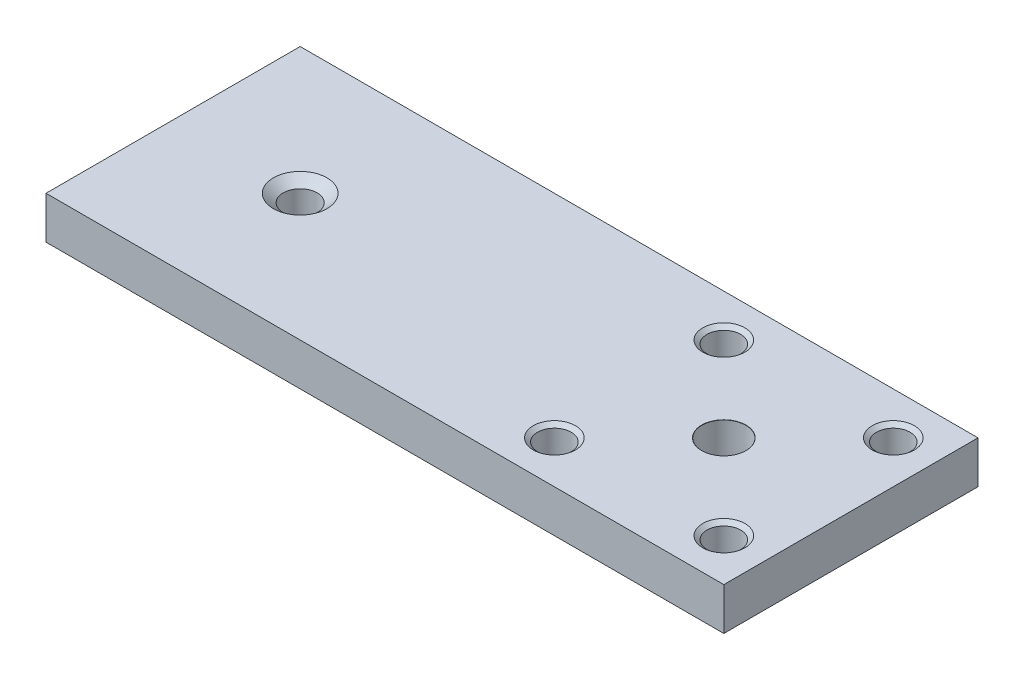
from build123d import *

# Parameters (mm, degrees)
SKETCH1_W                            = 101.6
SKETCH1_H                            = 38.1
BOSS_EXTRUDE1_DEPTH                  = 6.35
F_1_4_20_TAPPED_HOLE1_D              = 5.1054
F_1_4_20_TAPPED_HOLE1_CSINK_D        = 8.0264
F_1_4_20_TAPPED_HOLE1_CSINK_ANGLE    = 100
M6_CLEARANCE_HOLE1_D                 = 6.6
M6_CLEARANCE_HOLE1_CSINK_D           = 6.65
M6_CLEARANCE_HOLE1_CSINK_ANGLE       = 100
F_8_0_199_DIAMETER_HOLE1_D           = 5.0546
F_8_0_199_DIAMETER_HOLE1_CSINK_D     = 6.3246
F_8_0_199_DIAMETER_HOLE1_CSINK_ANGLE = 100


with BuildPart() as part:
    # Sketch1 → Boss-Extrude1 (new body)
    with BuildSketch(Plane(origin=(0, 0, 0), x_dir=(1, 0, 0), z_dir=(0, 1, 0))):
        with Locations((50.8, 19.05)):
            Rectangle(SKETCH1_W, SKETCH1_H)
    extrude(amount=BOSS_EXTRUDE1_DEPTH)

    # 1/4-20 Tapped Hole1 (through all)
    with Locations(Plane(origin=(0, 6.35, 0), x_dir=(1, 0, 0), z_dir=(0, 1, 0))):
        with Locations((19.05, 19.05)):
            CounterSinkHole(F_1_4_20_TAPPED_HOLE1_D / 2, F_1_4_20_TAPPED_HOLE1_CSINK_D / 2, counter_sink_angle=F_1_4_20_TAPPED_HOLE1_CSINK_ANGLE)

    # M6 Clearance Hole1 (through all)
    with Locations(Plane(origin=(0, 6.35, 0), x_dir=(1, 0, 0), z_dir=(0, 1, 0))):
        with Locations((82.55, 19.05)):
            CounterSinkHole(M6_CLEARANCE_HOLE1_D / 2, M6_CLEARANCE_HOLE1_CSINK_D / 2, counter_sink_angle=M6_CLEARANCE_HOLE1_CSINK_ANGLE)

    # #8 (0.199) Diameter Hole1 (through all)
    with Locations(Plane(origin=(0, 6.35, 0), x_dir=(1, 0, 0), z_dir=(0, 1, 0))):
        with Locations((95.25, 31.75), (69.85, 31.75), (69.85, 6.35), (95.25, 6.35)):
            CounterSinkHole(F_8_0_199_DIAMETER_HOLE1_D / 2, F_8_0_199_DIAMETER_HOLE1_CSINK_D / 2, counter_sink_angle=F_8_0_199_DIAMETER_HOLE1_CSINK_ANGLE)


solid = part.part
